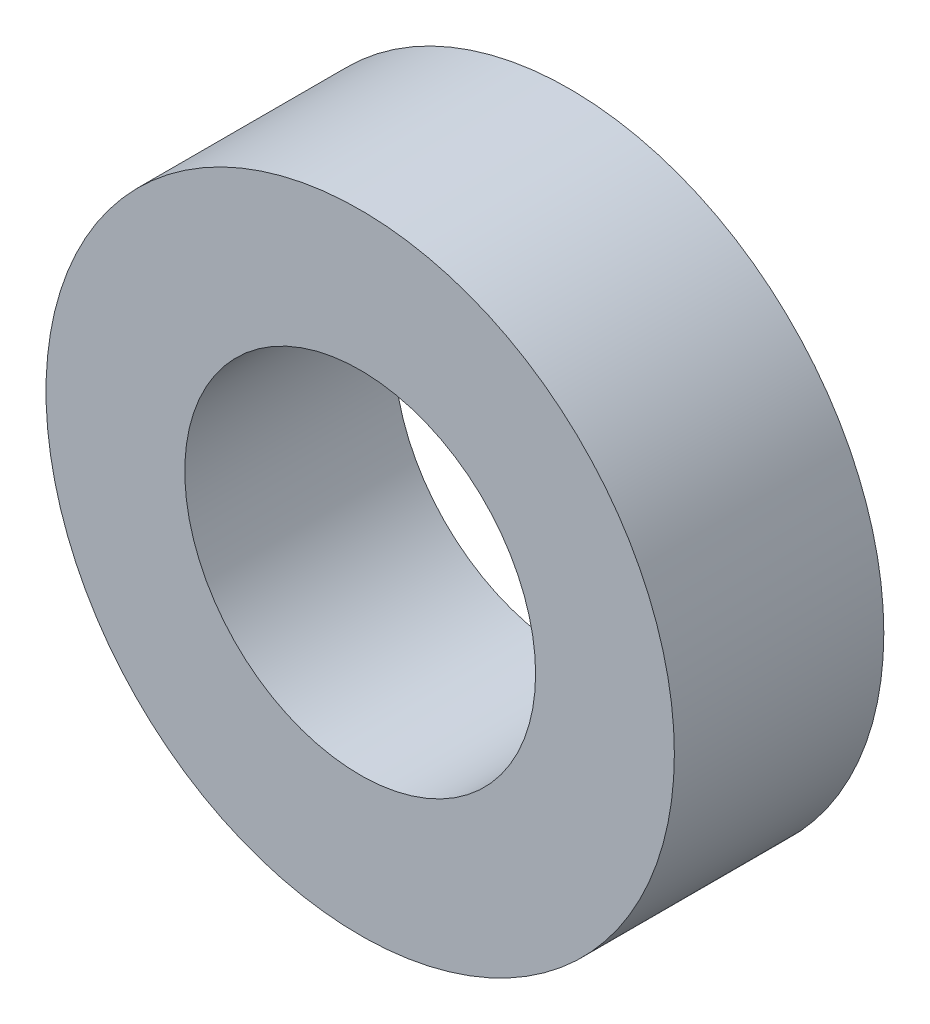
from build123d import *

# Parameters (mm, degrees)
SKETCH_1_R      = 3
SKETCH_1_R_2    = 1.675
EXTRUDE_1_DEPTH = 2


with BuildPart() as part:
    # 草图1 → 凸台-拉伸1 (new body)
    with BuildSketch(Plane.XY):
        Circle(SKETCH_1_R)
        Circle(SKETCH_1_R_2, mode=Mode.SUBTRACT)
    extrude(amount=EXTRUDE_1_DEPTH)


solid = part.part
